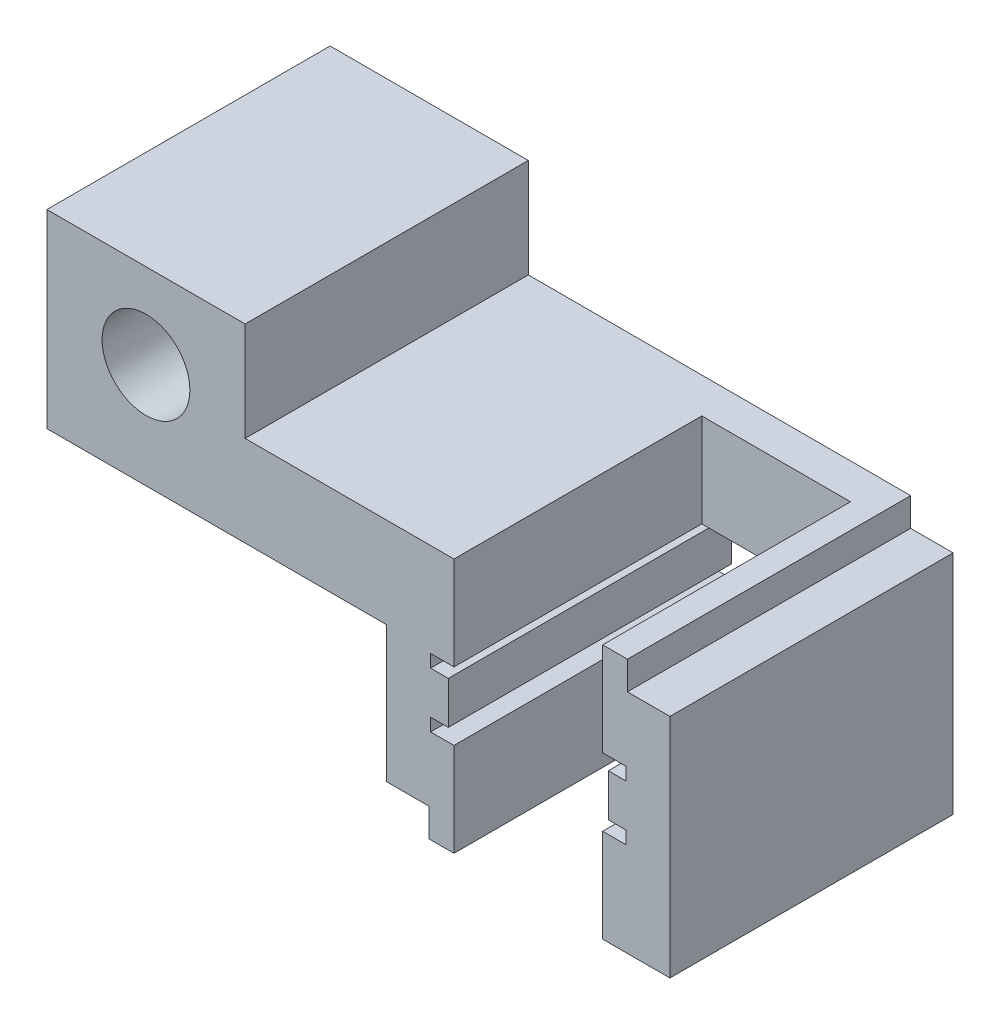
from build123d import *

# Parameters (mm, degrees)
SKETCH1_W           = 20
SKETCH1_H           = 3
BOSS_EXTRUDE1_DEPTH = 20
SKETCH3_W           = 20
SKETCH3_H           = 7.5
BOSS_EXTRUDE2_DEPTH = 20
SKETCH4_W           = 20
SKETCH4_H           = 7.5
BOSS_EXTRUDE3_DEPTH = 20
SKETCH2_W           = 11.3
SKETCH2_H           = 3
CUT_EXTRUDE1_DEPTH  = 20
SKETCH5_W           = 13.8
SKETCH5_H           = 0.9
CUT_EXTRUDE2_DEPTH  = 20
SKETCH6_W           = 10.5
SKETCH6_H           = 6.6
CUT_EXTRUDE3_DEPTH  = 17.5
SKETCH7_W           = 10.5
SKETCH7_H           = 6.6
CUT_EXTRUDE4_DEPTH  = 17.5
SKETCH8_W           = 3
SKETCH8_H           = 2
CUT_EXTRUDE5_DEPTH  = 20
SKETCH9_W           = 20
SKETCH9_H           = 13.4
BOSS_EXTRUDE4_DEPTH = 24
SKETCH10_R          = 3.1
CUT_EXTRUDE6_DEPTH  = 19
SKETCH11_R          = 1.45
CUT_EXTRUDE7_DEPTH  = 20
SKETCH12_W          = 10
SKETCH12_H          = 7
CUT_EXTRUDE8_DEPTH  = 20


with BuildPart() as part:
    # Sketch1 → Boss-Extrude1 (new body)
    with BuildSketch(Plane.XY):
        with Locations((0.456431535, 1.363070539)):
            Rectangle(SKETCH1_W, SKETCH1_H)
    extrude(amount=-BOSS_EXTRUDE1_DEPTH)

    # Sketch3 → Boss-Extrude2 (add)
    with BuildSketch(Plane.XY):
        with Locations((0.456431535, 6.613070539)):
            Rectangle(SKETCH3_W, SKETCH3_H)
    extrude(amount=-BOSS_EXTRUDE2_DEPTH)

    # Sketch4 → Boss-Extrude3 (add)
    with BuildSketch(Plane.XY):
        with Locations((0.456431535, -3.886929461)):
            Rectangle(SKETCH4_W, SKETCH4_H)
    extrude(amount=-BOSS_EXTRUDE3_DEPTH)

    # Sketch2 → Cut-Extrude1 (cut)
    with BuildSketch(Plane.XY):
        with Locations((0.456431535, 1.363070539)):
            Rectangle(SKETCH2_W, SKETCH2_H)
    extrude(amount=-CUT_EXTRUDE1_DEPTH, mode=Mode.SUBTRACT)

    # Sketch5 → Cut-Extrude2 (cut)
    with BuildSketch(Plane.XY):
        with Locations((0.456431535, -0.586929461)):
            Rectangle(SKETCH5_W, SKETCH5_H)
        with Locations((0.456431535, 3.313070539)):
            Rectangle(SKETCH5_W, SKETCH5_H)
    extrude(amount=-CUT_EXTRUDE2_DEPTH, mode=Mode.SUBTRACT)

    # Sketch6 → Cut-Extrude3 (cut)
    with BuildSketch(Plane.XY):
        with Locations((0.456431535, 7.063070539)):
            Rectangle(SKETCH6_W, SKETCH6_H)
    extrude(amount=-CUT_EXTRUDE3_DEPTH, mode=Mode.SUBTRACT)

    # Sketch7 → Cut-Extrude4 (cut)
    with BuildSketch(Plane.XY):
        with Locations((0.456431535, -4.336929461)):
            Rectangle(SKETCH7_W, SKETCH7_H)
    extrude(amount=-CUT_EXTRUDE4_DEPTH, mode=Mode.SUBTRACT)

    # Sketch8 → Cut-Extrude5 (cut)
    with BuildSketch(Plane.XY):
        with Locations((8.956431535, 9.363070539)):
            Rectangle(SKETCH8_W, SKETCH8_H)
        with Locations((-8.043568465, -6.636929461)):
            Rectangle(SKETCH8_W, SKETCH8_H)
    extrude(amount=-CUT_EXTRUDE5_DEPTH, mode=Mode.SUBTRACT)

    # Sketch9 → Boss-Extrude4 (add)
    with BuildSketch(Plane.ZY.offset(9.543568465)):
        with Locations((-10, 10.663070539)):
            Rectangle(SKETCH9_W, SKETCH9_H)
    extrude(amount=BOSS_EXTRUDE4_DEPTH)

    # Sketch10 → Cut-Extrude6 (cut)
    with BuildSketch(Plane.XY):
        with Locations((-26.543568465, 11.363070539)):
            Circle(SKETCH10_R)
    extrude(amount=-CUT_EXTRUDE6_DEPTH, mode=Mode.SUBTRACT)

    # Sketch11 → Cut-Extrude7 (cut)
    with BuildSketch(Plane.XY):
        with Locations((-26.543568465, 11.363070539)):
            Circle(SKETCH11_R)
    extrude(amount=-CUT_EXTRUDE7_DEPTH, mode=Mode.SUBTRACT)

    # Sketch12 → Cut-Extrude8 (cut)
    with BuildSketch(Plane.XY):
        with Locations((-14.543568465, 13.863070539)):
            Rectangle(SKETCH12_W, SKETCH12_H)
    extrude(amount=-CUT_EXTRUDE8_DEPTH, mode=Mode.SUBTRACT)


solid = part.part
